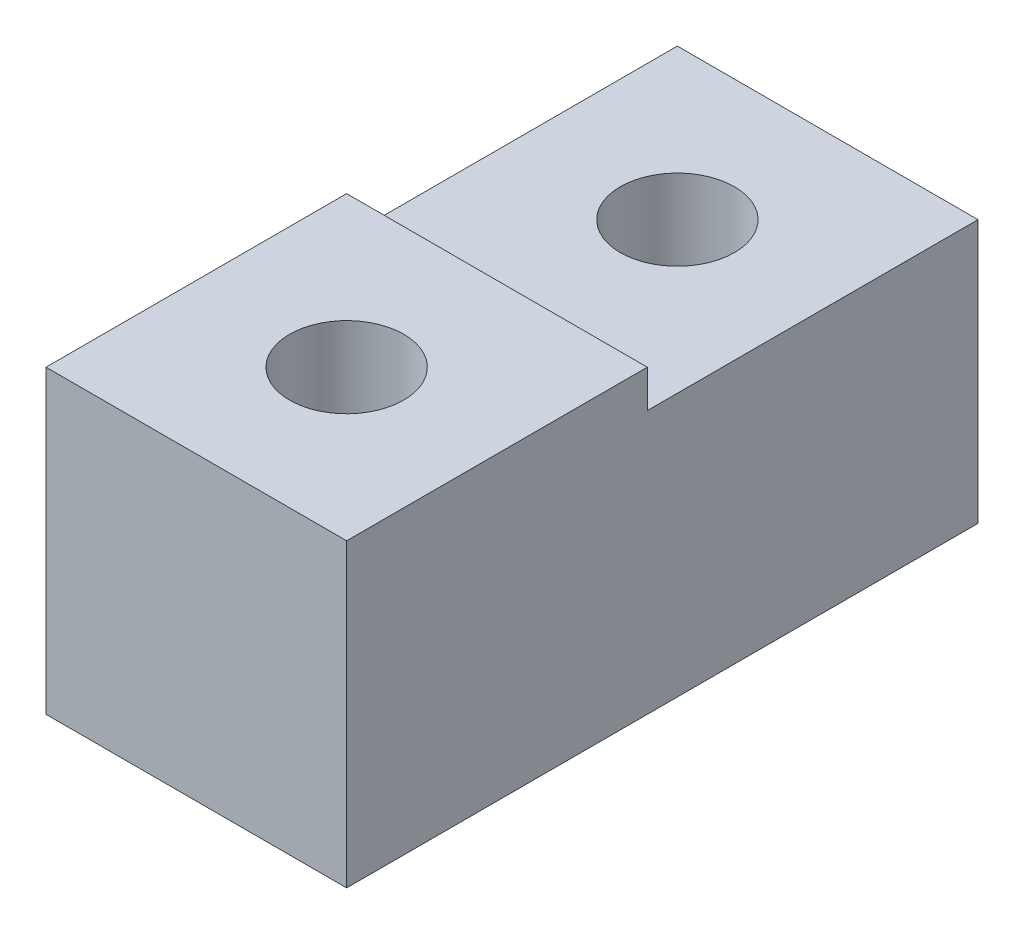
from build123d import *

# Parameters (mm, degrees)
SKETCH1_W                                           = 10
SKETCH1_H                                           = 21
BOSS_EXTRUDE1_DEPTH                                 = 10
SKETCH2_W                                           = 10
SKETCH2_H                                           = 11
CUT_EXTRUDE1_DEPTH                                  = 1.25
CBORE_FOR_6_BINDING_HEAD_MACHINE_SCREW1_D           = 3.7973
CBORE_FOR_6_BINDING_HEAD_MACHINE_SCREW1_CBORE_D     = 7.9375
CBORE_FOR_6_BINDING_HEAD_MACHINE_SCREW1_CBORE_DEPTH = 2.2098
CSK_FOR_6_FLAT_HEAD_MACHINE_SCREW_100_D             = 3.7973
CSK_FOR_6_FLAT_HEAD_MACHINE_SCREW_100_CSINK_D       = 7.0866
CSK_FOR_6_FLAT_HEAD_MACHINE_SCREW_100_CSINK_ANGLE   = 100


with BuildPart() as part:
    # Sketch1 → Boss-Extrude1 (new body)
    with BuildSketch(Plane(origin=(0, 0, 0), x_dir=(1, 0, 0), z_dir=(0, 1, 0))):
        Rectangle(SKETCH1_W, SKETCH1_H)
    extrude(amount=BOSS_EXTRUDE1_DEPTH)

    # Sketch2 → Cut-Extrude1 (cut)
    with BuildSketch(Plane(origin=(0, 10, 0), x_dir=(1, 0, 0), z_dir=(0, 1, 0))):
        with Locations((0, 5)):
            Rectangle(SKETCH2_W, SKETCH2_H)
    extrude(amount=-CUT_EXTRUDE1_DEPTH, mode=Mode.SUBTRACT)

    # CBORE for #6 Binding Head Machine Screw1 (through all)
    with Locations(Plane(origin=(0, 0, 0), x_dir=(-1, 0, 0), z_dir=(0, -1, 0))):
        with Locations((0, -5.5)):
            CounterBoreHole(CBORE_FOR_6_BINDING_HEAD_MACHINE_SCREW1_D / 2, CBORE_FOR_6_BINDING_HEAD_MACHINE_SCREW1_CBORE_D / 2, CBORE_FOR_6_BINDING_HEAD_MACHINE_SCREW1_CBORE_DEPTH)

    # CSK for #6 Flat Head Machine Screw (100)1 (through all)
    with Locations(Plane(origin=(0, 0, 0), x_dir=(-1, 0, 0), z_dir=(0, -1, 0))):
        with Locations((0, 5.5)):
            CounterSinkHole(CSK_FOR_6_FLAT_HEAD_MACHINE_SCREW_100_D / 2, CSK_FOR_6_FLAT_HEAD_MACHINE_SCREW_100_CSINK_D / 2, counter_sink_angle=CSK_FOR_6_FLAT_HEAD_MACHINE_SCREW_100_CSINK_ANGLE)


solid = part.part
